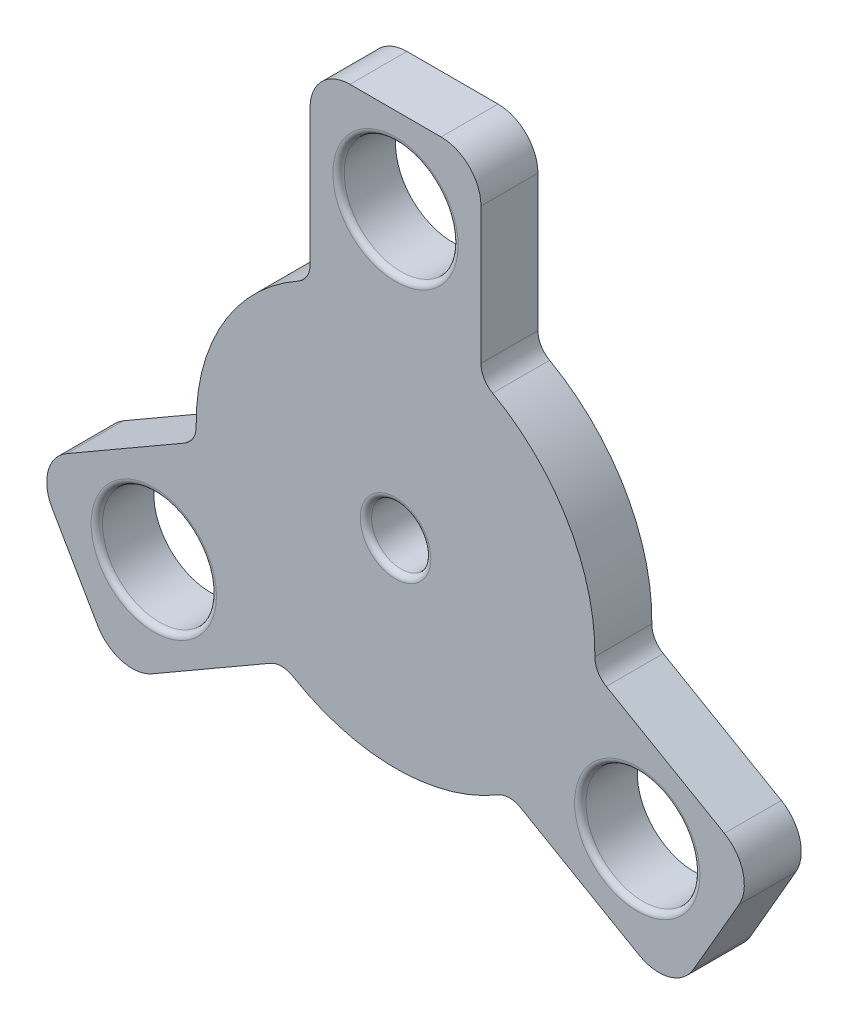
from build123d import *

# Parameters (mm, degrees)
SKETCH1_R           = 5
SKETCH1_R_2         = 17.5
SKETCH1_R_3         = 2.6
BOSS_EXTRUDE1_DEPTH = 5
FILLET1_R           = 3.5
FILLET2_R           = 2
FILLET3_R           = 0.5


with BuildPart() as part:
    # Sketch1 → Boss-Extrude1 (new body)
    # profile 1 of 4: a face of its own
    with BuildSketch(Plane.XY):
        with BuildLine():
            ThreePointArc((-9.943063938, -14.400884679), (-15.155444566, -8.75), (-17.443063938, -1.410503622))
            Line((-17.443063938, -1.410503622), (-31.895825623, -9.754809472))
            Line((-31.895825623, -9.754809472), (-24.395825623, -22.745190528))
            Line((-24.395825623, -22.745190528), (-9.943063938, -14.400884679))
        make_face()
        with Locations((-21.217622393, -12.25)):
            Circle(SKETCH1_R, mode=Mode.SUBTRACT)
    # profile 2 of 4: a face of its own
    with BuildSketch(Plane.XY):
        Circle(SKETCH1_R_2)
        Circle(SKETCH1_R_3, mode=Mode.SUBTRACT)
    # profile 3 of 4: a face of its own
    with BuildSketch(Plane.XY):
        with BuildLine():
            Line((31.895825623, -9.754809472), (17.443063938, -1.410503622))
            ThreePointArc((17.443063938, -1.410503622), (15.155444566, -8.75), (9.943063938, -14.400884679))
            Line((9.943063938, -14.400884679), (24.395825623, -22.745190528))
            Line((24.395825623, -22.745190528), (31.895825623, -9.754809472))
        make_face()
        with Locations((21.217622393, -12.25)):
            Circle(SKETCH1_R, mode=Mode.SUBTRACT)
    # profile 4 of 4: a face of its own
    with BuildSketch(Plane.XY):
        with BuildLine():
            Line((7.5, 32.5), (-7.5, 32.5))
            Line((-7.5, 32.5), (-7.5, 15.811388301))
            ThreePointArc((-7.5, 15.811388301), (0, 17.5), (7.5, 15.811388301))
            Line((7.5, 15.811388301), (7.5, 32.5))
        make_face()
        with Locations((0, 25)):
            Circle(SKETCH1_R, mode=Mode.SUBTRACT)
    extrude(amount=BOSS_EXTRUDE1_DEPTH)

    # Fillet1
    fillet1_edges = [part.edges().sort_by_distance(p)[0] for p in [
        (-24.395825623, -22.745190528, 2.5),
        (-31.895825623, -9.754809472, 2.5),
        (-7.5, 32.5, 2.5),
        (7.5, 32.5, 2.5),
        (31.895825623, -9.754809472, 2.5),
        (24.395825623, -22.745190528, 2.5),
    ]]
    fillet(fillet1_edges, radius=FILLET1_R)

    # Fillet2
    fillet2_edges = [part.edges().sort_by_distance(p)[0] for p in [
        (-17.443063938, -1.410503622, 2.5),
        (-7.5, 15.811388301, 2.5),
        (7.5, 15.811388301, 2.5),
        (17.443063938, -1.410503622, 2.5),
        (9.943063938, -14.400884679, 2.5),
        (-9.943063938, -14.400884679, 2.5),
    ]]
    fillet(fillet2_edges, radius=FILLET2_R)

    # Fillet3
    fillet3_edges = [part.edges().sort_by_distance(p)[0] for p in [
        (-2.6, 0, 5),
        (-5, 25, 5),
        (16.217622393, -12.25, 5),
        (-26.217622393, -12.25, 5),
    ]]
    fillet(fillet3_edges, radius=FILLET3_R)


solid = part.part
